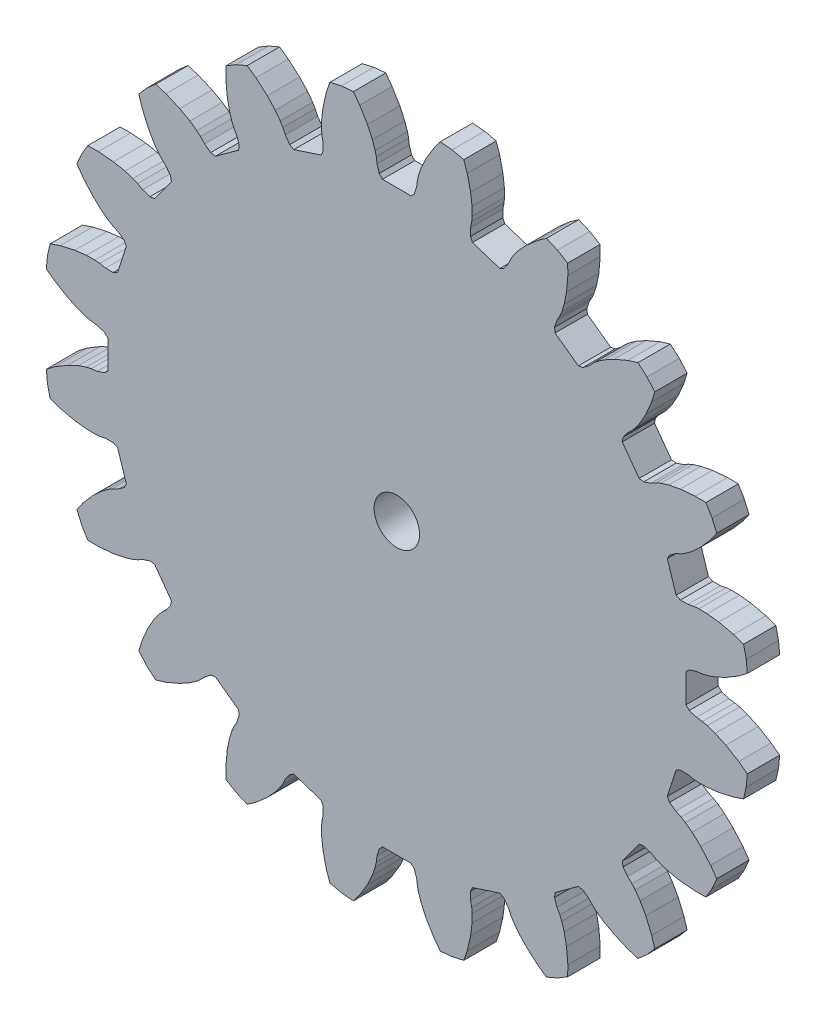
from build123d import *

# Parameters (mm, degrees)
SKETCH5_R           = 35
SKETCH5_R_2         = 2.25
BOSS_EXTRUDE1_DEPTH = 3.2
CUT_EXTRUDE1_DEPTH  = 76.509079187
CIRPATTERN1_COUNT   = 20


with BuildPart() as part:
    # Sketch5 → Boss-Extrude1 (new body)
    with BuildSketch(Plane.XY):
        with Locations((31.830988618, 0)):
            Circle(SKETCH5_R)
        with Locations((31.830988618, 0)):
            Circle(SKETCH5_R_2, mode=Mode.SUBTRACT)
    extrude(amount=BOSS_EXTRUDE1_DEPTH)

    # tooth_cut → Cut-Extrude1 (cut, through all)
    with BuildSketch(Plane.XY):
        with BuildLine():
            Line((3.233098862, 1.420819508), (3.233098862, -1.420819508))
            Line((3.233098862, -1.420819508), (2.892816804, -1.738815626))
            Line((2.892816804, -1.738815626), (2.176548442, -1.964919585))
            Line((2.176548442, -1.964919585), (1.599751534, -2.03453298))
            Line((1.599751534, -2.03453298), (1.113754294, -2.145678041))
            Line((1.113754294, -2.145678041), (0.329242102, -2.413997013))
            Line((0.329242102, -2.413997013), (-0.722824385, -2.901942124))
            Line((-0.722824385, -2.901942124), (-2.001840326, -3.666863287))
            Line((-2.001840326, -3.666863287), (-2.844736069, -4.299306919))
            Line((-2.844736069, -4.299306919), (-2.738103302, -5.475206276))
            ThreePointArc((-2.738103302, -5.475206276), (-3.169011382, 0), (-2.738103302, 5.475206276))
            Line((-2.738103302, 5.475206276), (-2.844736069, 4.299306919))
            Line((-2.844736069, 4.299306919), (-2.001840326, 3.666863287))
            Line((-2.001840326, 3.666863287), (-0.722824385, 2.901942124))
            Line((-0.722824385, 2.901942124), (0.329242102, 2.413997013))
            Line((0.329242102, 2.413997013), (1.113754294, 2.145678041))
            Line((1.113754294, 2.145678041), (1.599751534, 2.03453298))
            Line((1.599751534, 2.03453298), (2.176548442, 1.964919585))
            Line((2.176548442, 1.964919585), (2.892816804, 1.738815626))
            Line((2.892816804, 1.738815626), (3.233098862, 1.420819508))
        make_face()
    cut_extrude1 = extrude(amount=CUT_EXTRUDE1_DEPTH, mode=Mode.SUBTRACT)

    # CirPattern1: Cut-Extrude1 ×20 about axis
    cirpattern1_axis = Axis((31.830988618, 0, 0), (0, 0, 1))
    for i in range(1, CIRPATTERN1_COUNT):
        add(cut_extrude1.rotate(cirpattern1_axis, i * 360 / CIRPATTERN1_COUNT), mode=Mode.SUBTRACT)


solid = part.part
